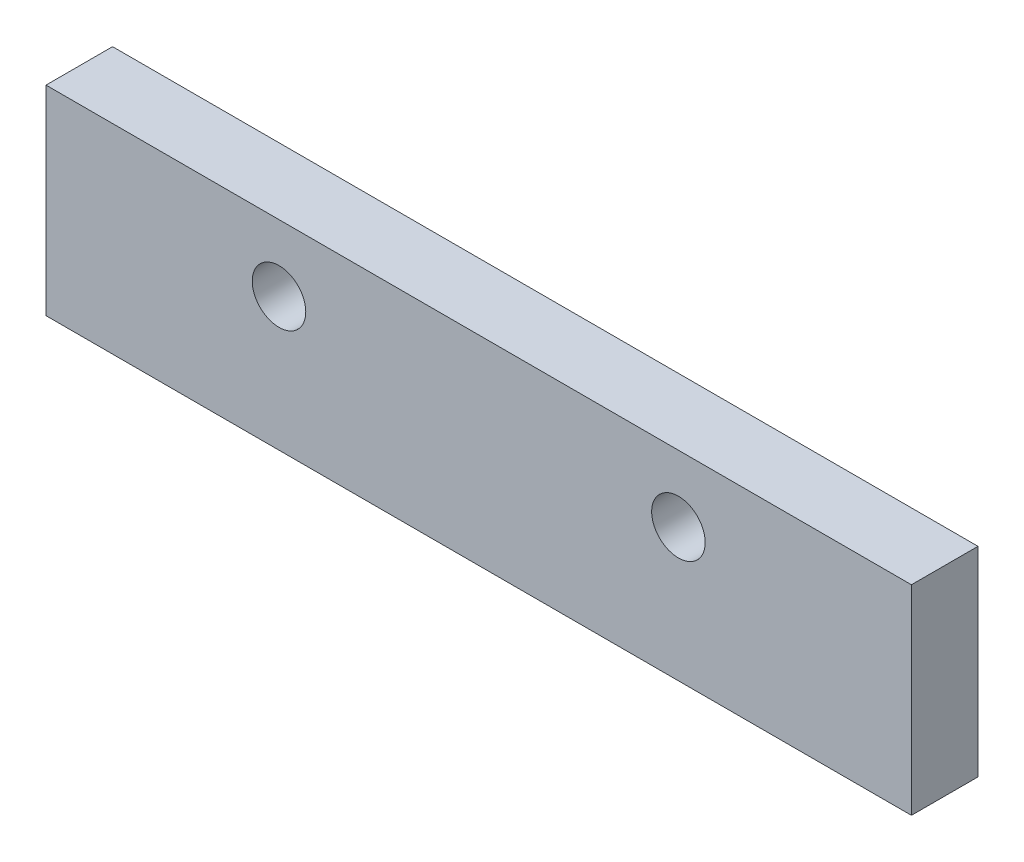
from build123d import *

# Parameters (mm, degrees)
SKETCH1_W               = 82.55
SKETCH1_H               = 19.05
BOSS_EXTRUDE1_DEPTH     = 6.35
F_1_4_20_TAPPED_HOLE1_D = 5.1054


with BuildPart() as part:
    # Sketch1 → Boss-Extrude1 (new body)
    with BuildSketch(Plane.XY):
        with Locations((41.275, 9.525)):
            Rectangle(SKETCH1_W, SKETCH1_H)
    extrude(amount=-BOSS_EXTRUDE1_DEPTH)

    # 1/4-20 Tapped Hole1 (through all)
    with Locations(Plane.XY):
        with Locations((22.225, 12.7), (60.325, 12.7)):
            Hole(F_1_4_20_TAPPED_HOLE1_D / 2)


solid = part.part
